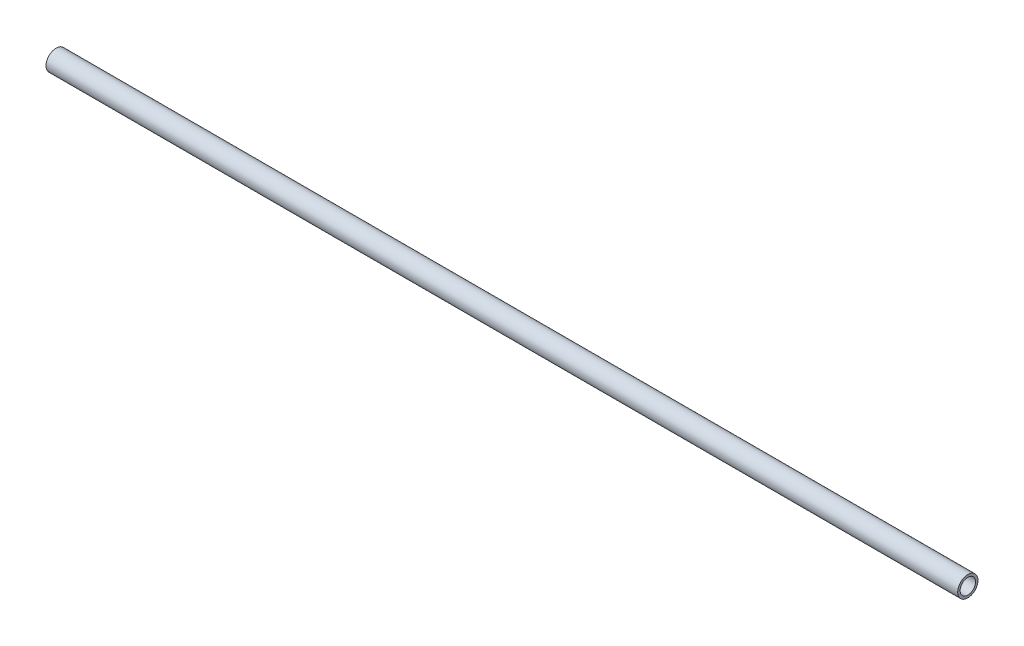
from build123d import *

# Parameters (mm, degrees)
SKETCH1_R           = 12.7
SKETCH1_R_2         = 9.652
BOSS_EXTRUDE1_DEPTH = 1140


with BuildPart() as part:
    # Sketch1 → Boss-Extrude1 (new body)
    with BuildSketch(Plane(origin=(0, 0, 0), x_dir=(0, 0, -1), z_dir=(1, 0, 0))):
        Circle(SKETCH1_R)
        Circle(SKETCH1_R_2, mode=Mode.SUBTRACT)
    extrude(amount=BOSS_EXTRUDE1_DEPTH)


solid = part.part
